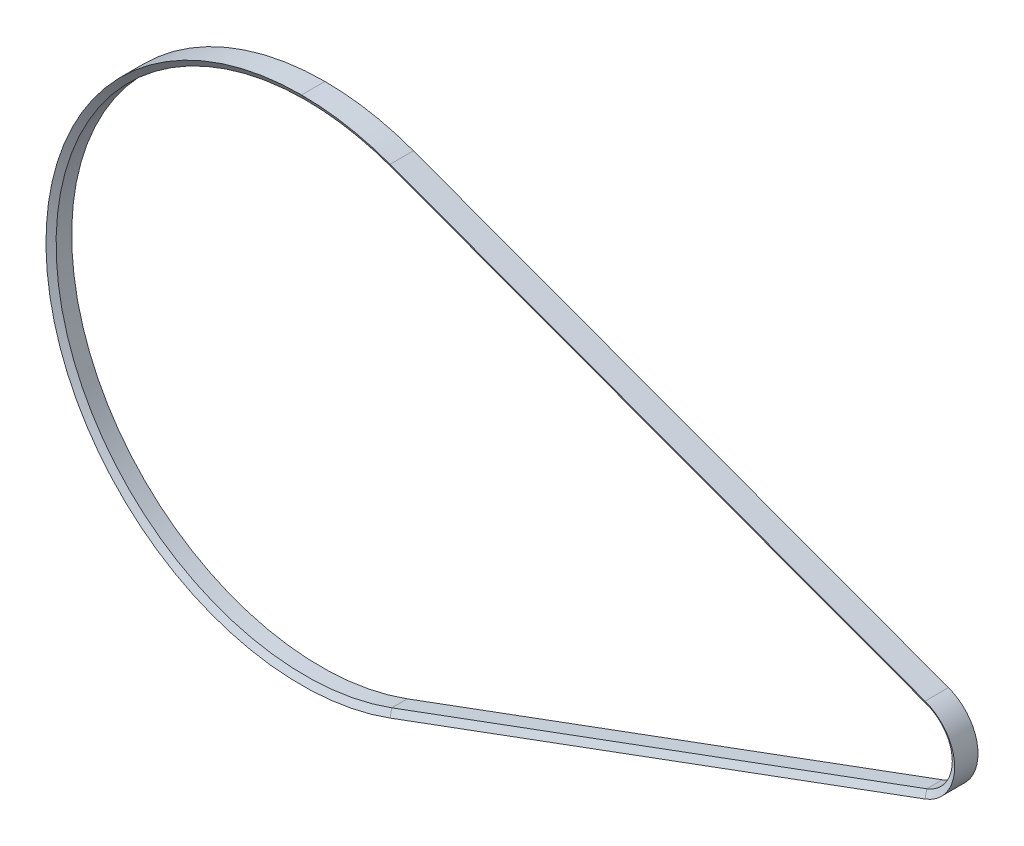
from build123d import *


with BuildPart() as part:
    # Sweep1: sweep along a path in Sketch1
    with BuildLine(Plane.XY) as sweep1_path:
        Line((70.338461538, 190.637721421), (506.290384615, 29.787143972))
        ThreePointArc((506.290384615, 29.787143972), (527.05, 0), (506.290384615, -29.787143972))
        Line((506.290384615, -29.787143972), (70.338461538, -190.637721421))
        ThreePointArc((70.338461538, -190.637721421), (-203.2, 0), (70.338461538, 190.637721421))
    # Sketch3 → Sweep1 (sweep)
    with BuildSketch(Plane(origin=(0, 0, 0), x_dir=(0, 0, -1), z_dir=(1, 0, 0))):
        Polygon((-6.35, 203.2), (6.35, 203.2), (9.525, 208.28), (-9.525, 208.28), align=None)
    sweep(path=sweep1_path.line)


solid = part.part
